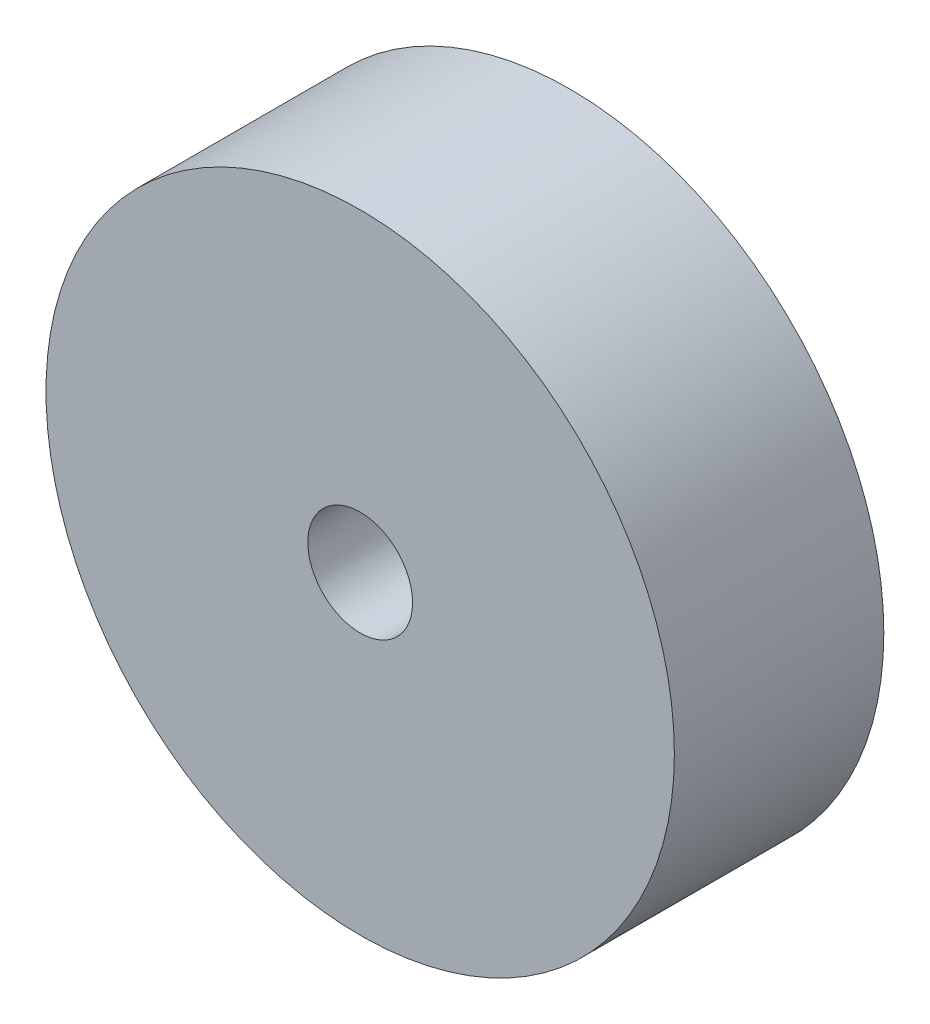
from build123d import *

# Parameters (mm, degrees)
SKETCH1_R           = 19.05
SKETCH1_R_2         = 3.175
BOSS_EXTRUDE1_DEPTH = 12.7


with BuildPart() as part:
    # Sketch1 → Boss-Extrude1 (new body)
    with BuildSketch(Plane.XY):
        Circle(SKETCH1_R)
        Circle(SKETCH1_R_2, mode=Mode.SUBTRACT)
    extrude(amount=BOSS_EXTRUDE1_DEPTH)


solid = part.part
